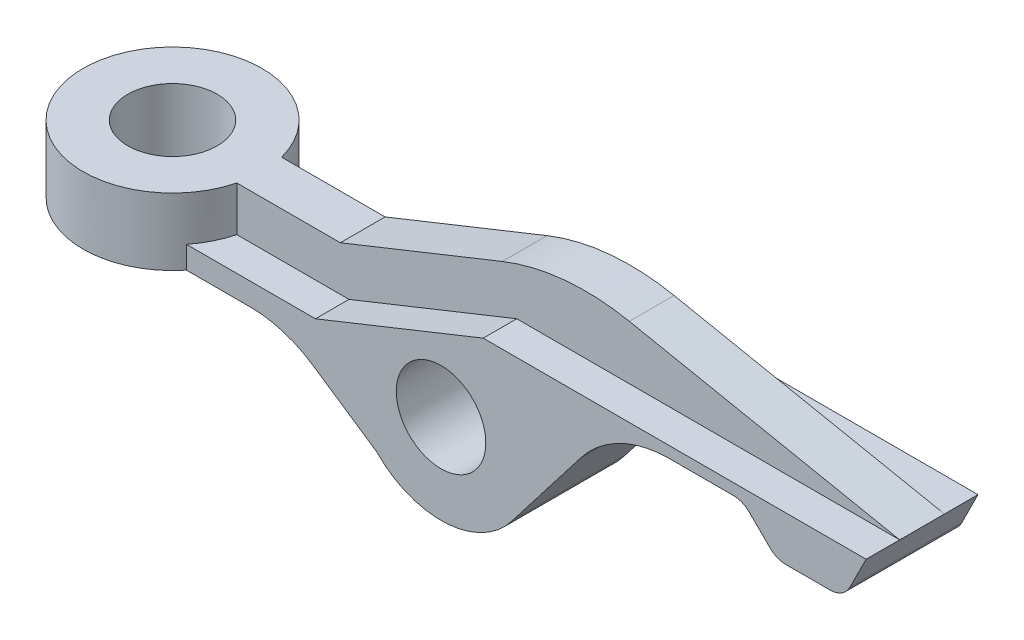
from build123d import *

# Parameters (mm, degrees)
BASE_EXTRUSION_DEPTH    = 1
BOSS_EXTRU_1_DEPTH      = 2.5
ESQUISSE3_R             = 4
ESQUISSE3_R_2           = 2
BOSS_EXTRU_2_DEPTH      = 3
ESQUISSE4_R             = 2
ENL_V_MAT_EXTRU_1_DEPTH = 22.141379606


with BuildPart() as part:
    # Esquisse1 → Base-Extrusion (new, symmetric)
    with BuildSketch(Plane.XY):
        with BuildLine():
            Line((-5.614835193, 1), (-12, 1))
            Line((-12, 1), (-12, 3))
            Line((-12, 3), (-6, 3))
            Line((-6, 3), (1.239910882, 5.895964353))
            ThreePointArc((1.239910882, 5.895964353), (4.039542112, 6.569314748), (6.914978997, 6.417004201))
            Line((6.914978997, 6.417004201), (19, 4))
            Line((19, 4), (1.885164807, 4))
            Line((1.885164807, 4), (-5.614835193, 1))
        make_face()
    extrude(amount=BASE_EXTRUSION_DEPTH, both=True)

    # Esquisse2 → Boss.-Extru.1 (add, symmetric)
    with BuildSketch(Plane.XY):
        with BuildLine():
            Line((3.235852124, -2.351438077), (6.251216165, 1.555118833))
            ThreePointArc((6.251216165, 1.555118833), (8.004237079, 2.987515692), (10.209277422, 3.5))
            Line((10.209277422, 3.5), (13.070517185, 3.5))
            ThreePointArc((13.070517185, 3.5), (13.450300787, 3.425075357), (13.773174087, 3.211528832))
            Line((13.773174087, 3.211528832), (14.707886519, 2.288471168))
            ThreePointArc((14.707886519, 2.288471168), (15.030759819, 2.074924643), (15.410543421, 2))
            Line((15.410543421, 2), (17.381966011, 2))
            ThreePointArc((17.381966011, 2), (17.907697123, 2.149349192), (18.276393202, 2.552786405))
            Line((18.276393202, 2.552786405), (19, 4))
            Line((19, 4), (1.885164807, 4))
            Line((1.885164807, 4), (-5.614835193, 1))
            Line((-5.614835193, 1), (-12, 1))
            Line((-12, 1), (-12, 0))
            Line((-12, 0), (-8.52733926, 0))
            ThreePointArc((-8.52733926, 0), (-7.066630162, -0.218124957), (-5.733367907, -0.853468427))
            Line((-5.733367907, -0.853468427), (-2.879455607, -2.776460951))
            ThreePointArc((-2.879455607, -2.776460951), (0.277336853, -3.990373951), (3.235852124, -2.351438077))
        make_face()
    extrude(amount=BOSS_EXTRU_1_DEPTH, both=True)

    # Esquisse3 → Boss.-Extru.2 (add)
    with BuildSketch(Plane.XZ):
        with Locations((-14.5, 0)):
            Circle(ESQUISSE3_R)
        with Locations((-14.5, 0)):
            Circle(ESQUISSE3_R_2, mode=Mode.SUBTRACT)
    extrude(amount=-BOSS_EXTRU_2_DEPTH)

    # Esquisse4 → Enlèv. mat.-Extru.1 (cut, through all)
    with BuildSketch(Plane(origin=(0, 0, -2.5), x_dir=(-1, 0, 0), z_dir=(0, 0, -1))):
        Circle(ESQUISSE4_R)
    extrude(amount=-ENL_V_MAT_EXTRU_1_DEPTH, mode=Mode.SUBTRACT)


solid = part.part
